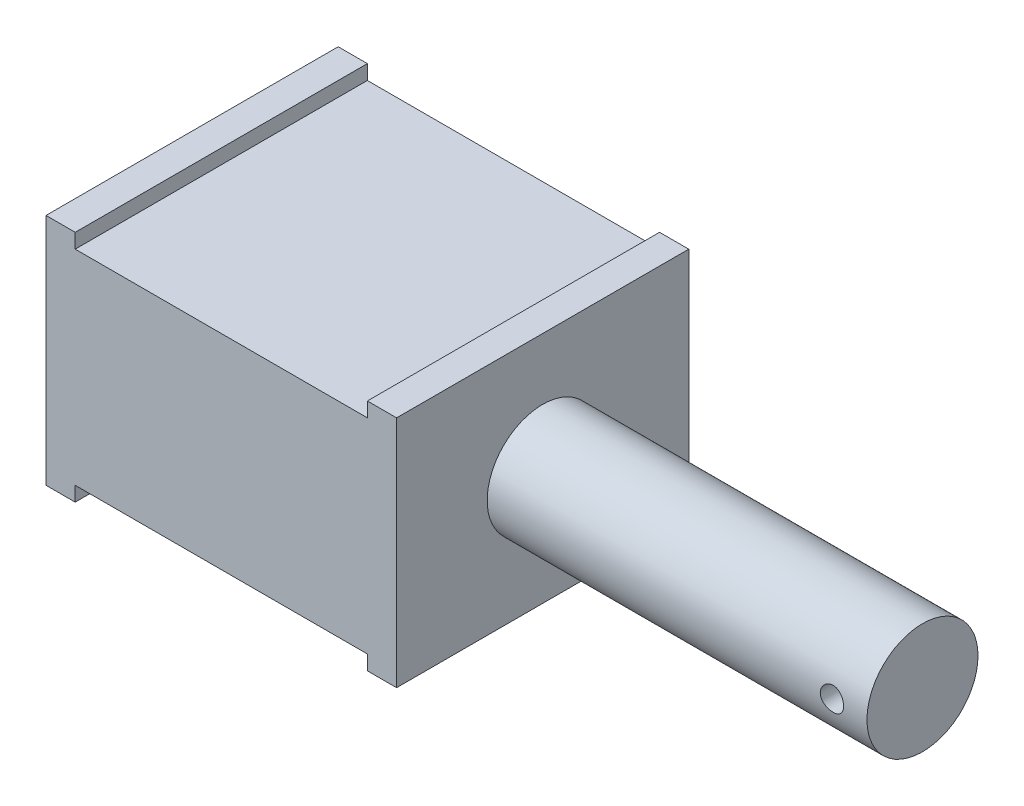
from build123d import *

# Parameters (mm, degrees)
SKETCH1_W               = 10
SKETCH1_H               = 8
BOSS_EXTRUDE5_DEPTH     = 12
SKETCH2_R               = 1.9
BOSS_EXTRUDE6_DEPTH     = 13
CUT_EXTRUDE1_DEPTH      = 3
CUT_EXTRUDE1_DEPTH_BACK = 3
SKETCH3_R               = 0.4
SKETCH4_W               = 10
SKETCH4_H               = 0.5
CUT_EXTRUDE2_DEPTH      = 10
SCALE1_SCALE            = 1.5


with BuildPart() as part:
    # Sketch1 → Boss-Extrude5 (new body)
    with BuildSketch(Plane(origin=(0, 0, 0), x_dir=(0, 0, -1), z_dir=(1, 0, 0))):
        with Locations((5, 4)):
            Rectangle(SKETCH1_W, SKETCH1_H)
    extrude(amount=BOSS_EXTRUDE5_DEPTH)

    # Sketch2 → Boss-Extrude6 (add)
    with BuildSketch(Plane(origin=(12, 0, 0), x_dir=(0, 0, -1), z_dir=(1, 0, 0))):
        with Locations(Location((5, 4, 0), (0, 0, 180))):
            Circle(SKETCH2_R)
    extrude(amount=BOSS_EXTRUDE6_DEPTH)

    # Sketch3 → Cut-Extrude1 (cut, two sides: drawn at the far end of the back side and taken through both)
    with BuildSketch(Plane(origin=(0, 0, -5), x_dir=(-1, 0, 0), z_dir=(0, 0, -1)).offset(-CUT_EXTRUDE1_DEPTH_BACK)):
        with Locations(Location((-23.8, 4, 0), (0, 0, 180))):
            Circle(SKETCH3_R)
    extrude(amount=CUT_EXTRUDE1_DEPTH + CUT_EXTRUDE1_DEPTH_BACK, mode=Mode.SUBTRACT)

    # Sketch4 → Cut-Extrude2 (cut)
    with BuildSketch(Plane(origin=(0, 0, -10), x_dir=(-1, 0, 0), z_dir=(0, 0, -1))):
        with Locations((-6, 7.75)):
            Rectangle(SKETCH4_W, SKETCH4_H)
        with Locations((-6, 0.25)):
            Rectangle(SKETCH4_W, SKETCH4_H)
    extrude(amount=-CUT_EXTRUDE2_DEPTH, mode=Mode.SUBTRACT)


with BuildPart() as part_1:
    # Scale1: scaled about (0, 0, 0)
    add(part.part.scale(SCALE1_SCALE))


solid = part_1.part
